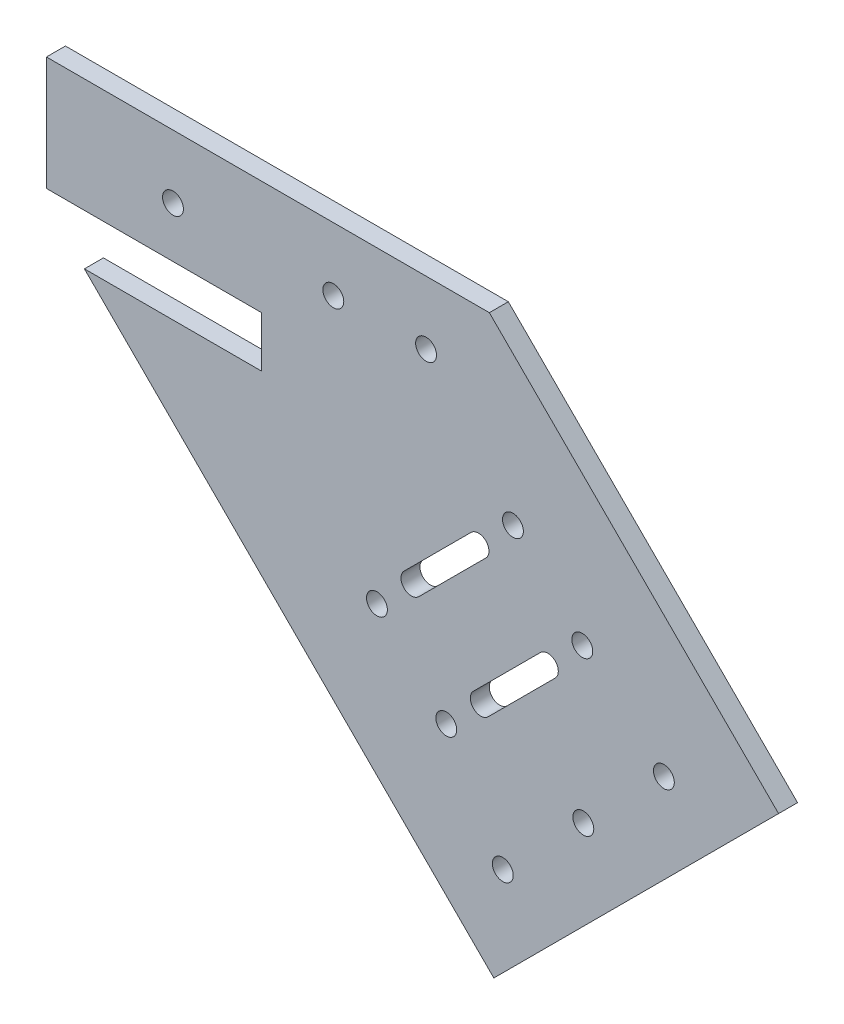
from build123d import *

# Parameters (mm, degrees)
EXTRUDE_1_DEPTH     = 3
SKETCH_2_R          = 1.65
CUT_EXTRUDE_1_DEPTH = 148.059131493
CUT_EXTRUDE_2_DEPTH = 10


with BuildPart() as part:
    # 草图1 → 凸台-拉伸1 (new body)
    with BuildSketch(Plane.XY):
        Polygon((0, 0), (70, 0), (115.710678119, -45.710678119), (70.710678119, -90.710678119), (0, -20), align=None)
    extrude(amount=EXTRUDE_1_DEPTH)

    # 草图2 → 切除-拉伸1 (cut, through all)
    with BuildSketch(Plane.XY.offset(3)):
        with Locations((72.124891681, -75.154328933)):
            Circle(SKETCH_2_R)
        with Locations((97.580735804, -49.69848481)):
            Circle(SKETCH_2_R)
        with Locations((20, -10)):
            Circle(SKETCH_2_R)
        with Locations((45.34, -10)):
            Circle(SKETCH_2_R)
        with Locations((60, -10)):
            Circle(SKETCH_2_R)
        with Locations((73.729886297, -27.233840149)):
            Circle(SKETCH_2_R)
        with Locations((52.233840149, -48.729886297)):
            Circle(SKETCH_2_R)
        with Locations(Location((84.690041405, -38.193995257, 0), (0, 0, 180))):
            Circle(SKETCH_2_R)
        with Locations(Location((63.193995257, -59.690041405, 0), (0, 0, 180))):
            Circle(SKETCH_2_R)
        with Locations((84.852813742, -62.426406871)):
            Circle(SKETCH_2_R)
        with BuildLine():
            Line((56.511836175, -42.118437893), (67.118437893, -31.511836175))
            ThreePointArc((67.118437893, -31.511836175), (69.451890271, -31.511836175), (69.451890271, -33.845288553))
            Line((69.451890271, -33.845288553), (58.845288553, -44.451890271))
            ThreePointArc((58.845288553, -44.451890271), (56.511836175, -44.451890271), (56.511836175, -42.118437893))
        make_face()
        with BuildLine():
            Line((69.805443661, -55.412045379), (80.412045379, -44.805443661))
            ThreePointArc((80.412045379, -44.805443661), (80.412045379, -42.471991283), (78.078593001, -42.471991283))
            Line((78.078593001, -42.471991283), (67.471991283, -53.078593001))
            ThreePointArc((67.471991283, -53.078593001), (67.471991283, -55.412045379), (69.805443661, -55.412045379))
        make_face()
    extrude(amount=-CUT_EXTRUDE_1_DEPTH, mode=Mode.SUBTRACT)

    # 草图3 → 切除-拉伸2 (cut)
    with BuildSketch(Plane(origin=(0, 0, 0), x_dir=(-1, 0, 0), z_dir=(0, 0, -1))):
        Polygon((-34, -18), (2, -18), (-6, -26), (-34, -26), align=None)
    extrude(amount=-CUT_EXTRUDE_2_DEPTH, mode=Mode.SUBTRACT)


solid = part.part
